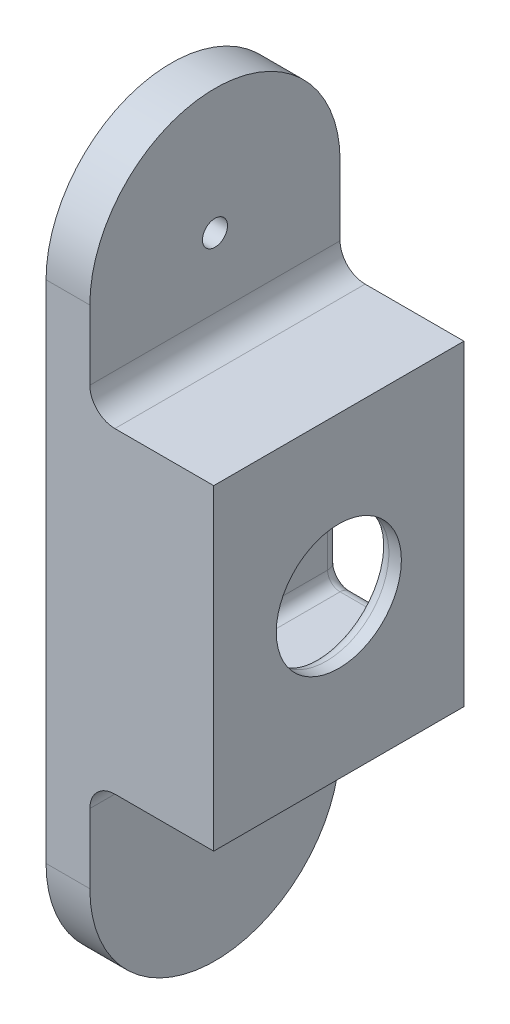
from build123d import *

# Parameters (mm, degrees)
SKETCH1_R           = 5
SKETCH1_R_2         = 1
BOSS_EXTRUDE1_DEPTH = 3.5
BOSS_EXTRUDE2_DEPTH = 7.9
SKETCH3_W           = 20
SKETCH3_H           = 25.3
SKETCH3_R           = 5
BOSS_EXTRUDE3_DEPTH = 2
FILLET1_R           = 2
FILLET2_R           = 1


with BuildPart() as part:
    # Sketch1 → Boss-Extrude1 (new body)
    with BuildSketch(Plane(origin=(0, 0, 0), x_dir=(0, 0, -1), z_dir=(1, 0, 0))):
        with BuildLine():
            Line((10, -20.2), (10, 20.2))
            ThreePointArc((10, 20.2), (0, 30.2), (-10, 20.2))
            Line((-10, 20.2), (-10, -20.2))
            ThreePointArc((-10, -20.2), (0, -30.2), (10, -20.2))
        make_face()
        Circle(SKETCH1_R, mode=Mode.SUBTRACT)
        with Locations((0, 20.2)):
            Circle(SKETCH1_R_2, mode=Mode.SUBTRACT)
        with Locations((0, -20.2)):
            Circle(SKETCH1_R_2, mode=Mode.SUBTRACT)
    extrude(amount=BOSS_EXTRUDE1_DEPTH)

    # Sketch2 → Boss-Extrude2 (add)
    with BuildSketch(Plane(origin=(3.5, 0, 0), x_dir=(0, 0, -1), z_dir=(1, 0, 0))):
        Polygon((-9.988159657, 0), (-4.994079828, 8.65), (10, 8.65), (10, 12.65), (-10, 12.65), (-10, -12.65), (10, -12.65), (10, -8.65), (-4.994079828, -8.65), align=None)
    extrude(amount=BOSS_EXTRUDE2_DEPTH)

    # Sketch3 → Boss-Extrude3 (add)
    with BuildSketch(Plane(origin=(11.4, 0, 0), x_dir=(0, 0, -1), z_dir=(1, 0, 0))):
        Rectangle(SKETCH3_W, SKETCH3_H)
        Circle(SKETCH3_R, mode=Mode.SUBTRACT)
    extrude(amount=BOSS_EXTRUDE3_DEPTH)

    # Fillet1
    fillet1_edges = [part.edges().sort_by_distance(p)[0] for p in [
        (7.45, 0, 9.988159657),
        (3.5, -12.65, 0),
        (3.5, 12.65, 0),
    ]]
    fillet(fillet1_edges, radius=FILLET1_R)

    # Fillet2
    fillet2_edges = [part.edges().sort_by_distance(p)[0] for p in [
        (3.5, 0, -10),
        (11.4, -8.65, -2.502960086),
        (7.45, -8.65, -10),
        (11.4, 4.825, 7.202444608),
        (3.5, 8.65, -2.502960086),
        (7.45, 8.65, -10),
        (11.4, 8.65, -2.502960086),
        (3.5, -8.65, -2.502960086),
        (3.5, 4.825, 7.202444608),
        (11.4, 0, 5),
        (11.4, 0, -10),
        (3.5, -4.825, 7.202444608),
        (3.5, 0, 9.67875858),
        (11.4, -4.825, 7.202444608),
        (11.4, 0, 9.67875858),
        (3.5, 0, 5),
    ]]
    fillet(fillet2_edges, radius=FILLET2_R)


solid = part.part
